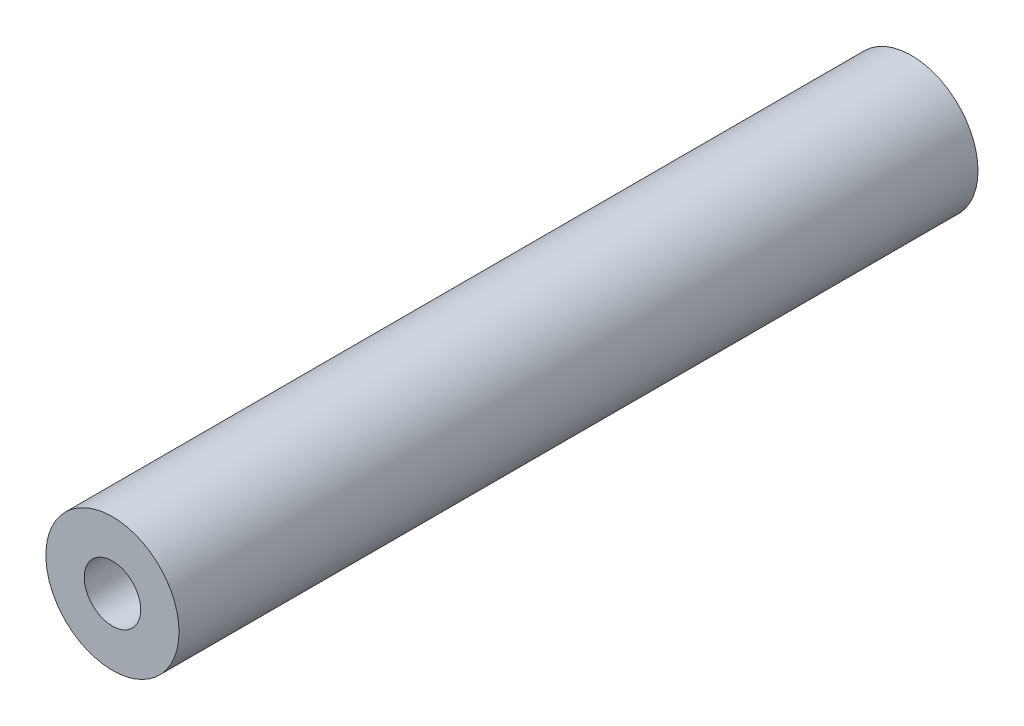
from build123d import *

# Parameters (mm, degrees)
SKETCH1_R           = 4.7625
SKETCH1_R_2         = 2.0193
BOSS_EXTRUDE1_DEPTH = 57.15


with BuildPart() as part:
    # Sketch1 → Boss-Extrude1 (new body)
    with BuildSketch(Plane.XY):
        Circle(SKETCH1_R)
        Circle(SKETCH1_R_2, mode=Mode.SUBTRACT)
    extrude(amount=BOSS_EXTRUDE1_DEPTH)


solid = part.part
